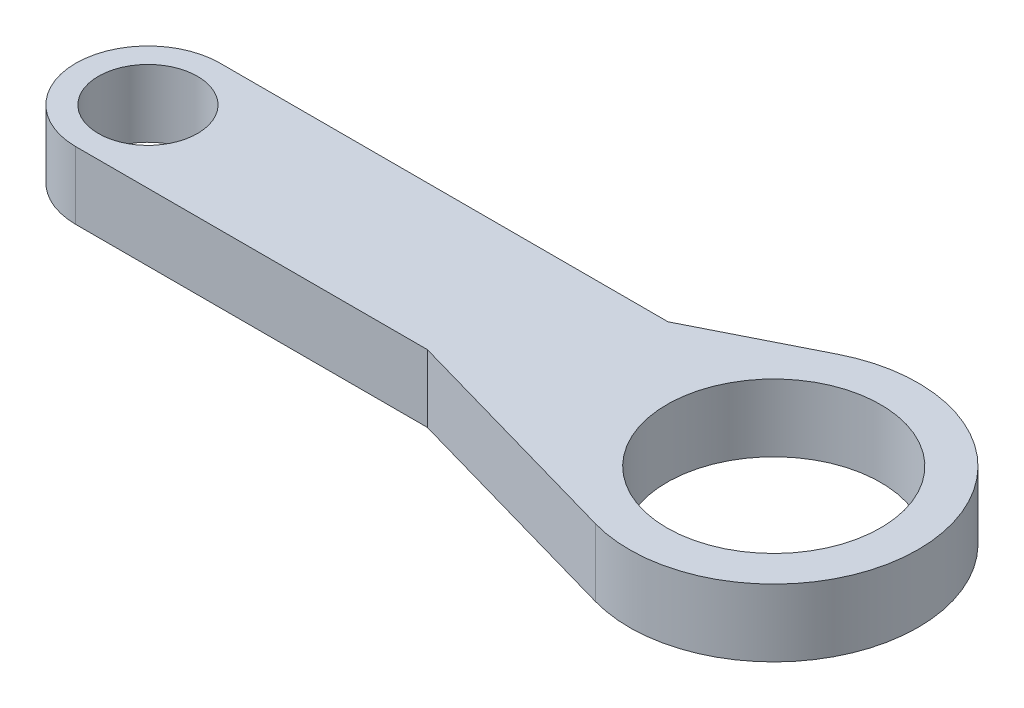
from build123d import *

# Parameters (mm, degrees)
SKETCH2_R           = 5.15
SKETCH2_R_2         = 11.1
BOSS_EXTRUDE2_DEPTH = 3.5


with BuildPart() as part:
    # Sketch2 → Boss-Extrude2 (new, symmetric)
    with BuildSketch(Plane(origin=(0, 0, 0), x_dir=(1, 0, 0), z_dir=(0, 1, 0))):
        with BuildLine():
            Line((-18.484269322, 7.5), (-65, 7.5))
            ThreePointArc((-65, 7.5), (-72.5, 0), (-65, -7.5))
            Line((-65, -7.5), (-28.484269322, -7.5))
            Line((-28.484269322, -7.5), (-4.099945578, -14.428806127))
            ThreePointArc((-4.099945578, -14.428806127), (14.933269082, 1.413320387), (-6.734057037, 13.403450146))
            Line((-6.734057037, 13.403450146), (-18.484269322, 7.5))
        make_face()
        with Locations(Location((-65, 0, 0), (0, 0, 270))):
            Circle(SKETCH2_R, mode=Mode.SUBTRACT)
        with Locations(Location((0, 0, 0), (0, 0, 270))):
            Circle(SKETCH2_R_2, mode=Mode.SUBTRACT)
    extrude(amount=BOSS_EXTRUDE2_DEPTH, both=True)


solid = part.part
